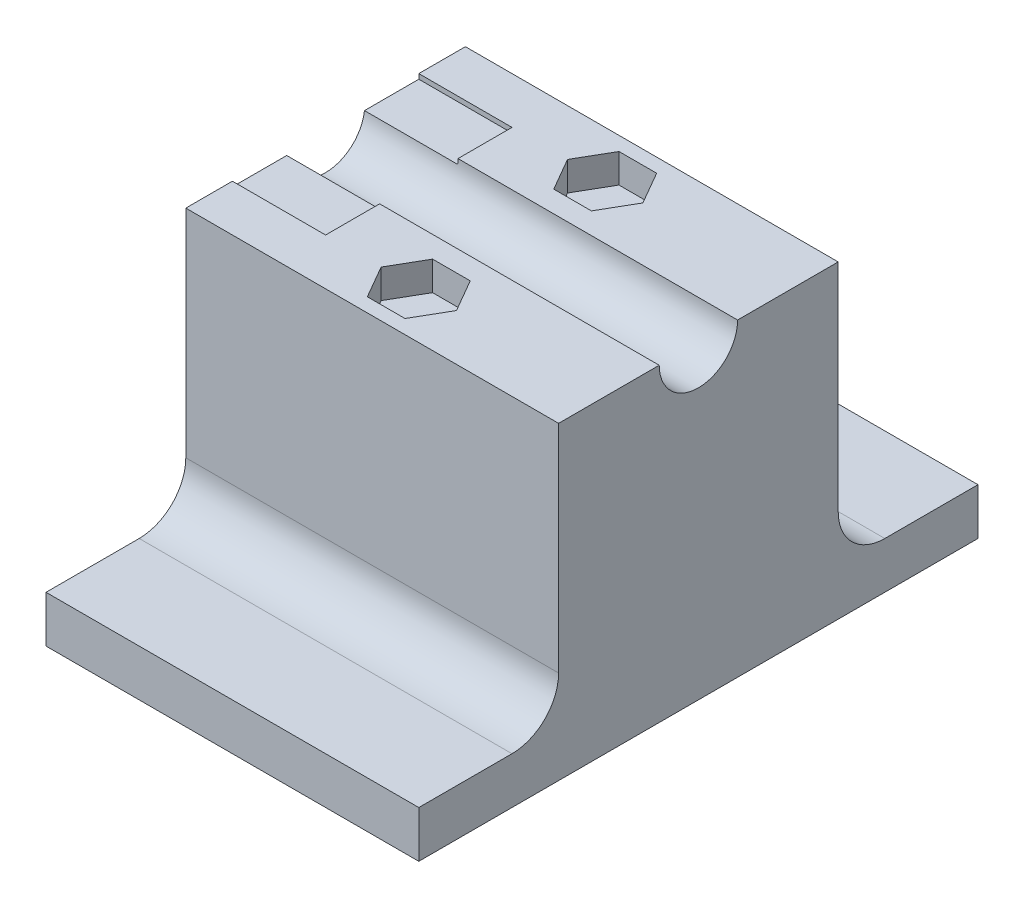
from build123d import *

# Parameters (mm, degrees)
SKETCH1_W           = 40
SKETCH1_H           = 30
BOSS_EXTRUDE1_DEPTH = 33.2
SKETCH2_R           = 4.205
CUT_EXTRUDE1_DEPTH  = 55.103973976
CUT_EXTRUDE2_DEPTH  = 3.12
SKETCH4_W           = 60
SKETCH4_H           = 5
BOSS_EXTRUDE2_DEPTH = 40
FILLET1_R           = 5
SKETCH5_W           = 20
SKETCH5_H           = 1.05
CUT_EXTRUDE3_DEPTH  = 10


with BuildPart() as part:
    # Sketch1 → Boss-Extrude1 (new body)
    with BuildSketch(Plane(origin=(0, 0, 0), x_dir=(1, 0, 0), z_dir=(0, 1, 0))):
        Rectangle(SKETCH1_W, SKETCH1_H)
    extrude(amount=BOSS_EXTRUDE1_DEPTH)

    # Sketch2 → Cut-Extrude1 (cut, through all)
    with BuildSketch(Plane.ZY.offset(20)):
        with Locations((0, 33.2)):
            Circle(SKETCH2_R)
    extrude(amount=-CUT_EXTRUDE1_DEPTH, mode=Mode.SUBTRACT)

    # Sketch3 → Cut-Extrude2 (cut)
    with BuildSketch(Plane(origin=(0, 33.2, 0), x_dir=(1, 0, 0), z_dir=(0, 1, 0))):
        Polygon((2.020725942, 6.5), (4.041451884, 10), (2.020725942, 13.5), (-2.020725942, 13.5), (-4.041451884, 10), (-2.020725942, 6.5), align=None)
    cut_extrude2 = extrude(amount=-CUT_EXTRUDE2_DEPTH, mode=Mode.SUBTRACT)

    # Mirror1: Cut-Extrude2 across plane
    add(cut_extrude2.mirror(Plane.XY), mode=Mode.SUBTRACT)

    # Sketch4 → Boss-Extrude2 (add)
    with BuildSketch(Plane(origin=(20, 0, 0), x_dir=(0, 0, -1), z_dir=(1, 0, 0))):
        with Locations((0, 2.5)):
            Rectangle(SKETCH4_W, SKETCH4_H)
    extrude(amount=-BOSS_EXTRUDE2_DEPTH)

    # Fillet1
    fillet1_edges = [part.edges().sort_by_distance(p)[0] for p in [
        (0, 5, -15),
        (0, 5, 15),
    ]]
    fillet(fillet1_edges, radius=FILLET1_R)

    # Sketch5 → Cut-Extrude3 (cut)
    with BuildSketch(Plane.ZY.offset(20)):
        with Locations((0, 33.2)):
            Rectangle(SKETCH5_W, SKETCH5_H)
    extrude(amount=-CUT_EXTRUDE3_DEPTH, mode=Mode.SUBTRACT)


solid = part.part
